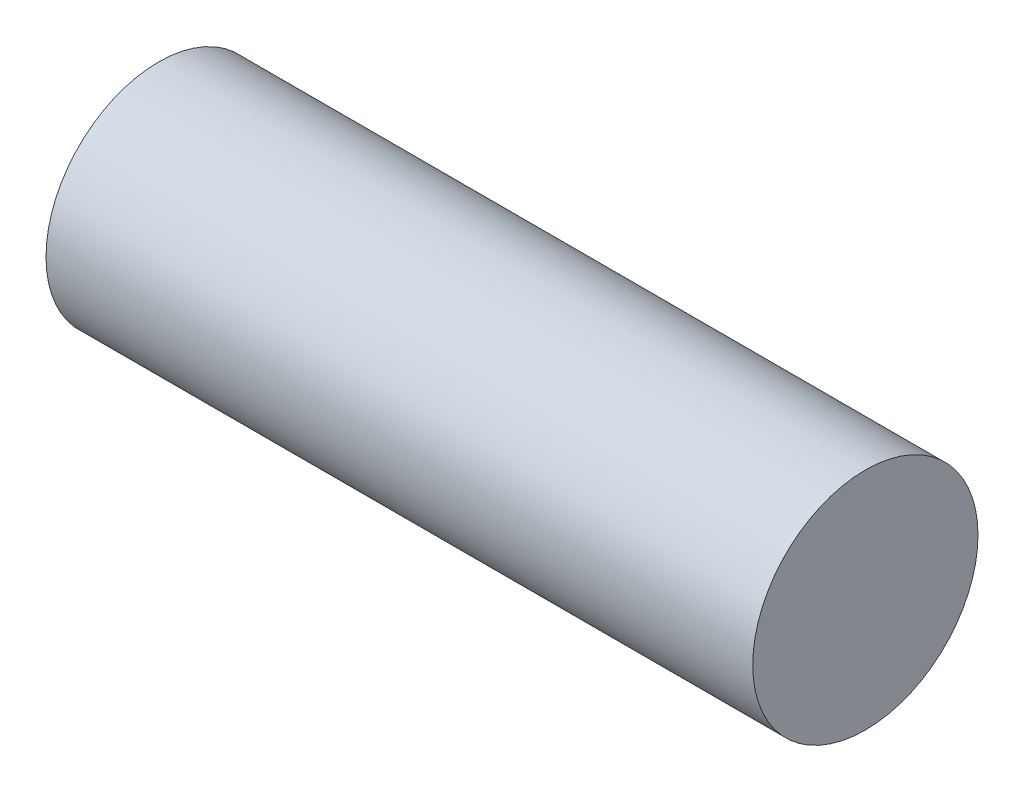
from build123d import *

# Parameters (mm, degrees)
SKETCH2_W = 400
SKETCH2_H = 63.75


with BuildPart() as part:
    # Sketch2 → Revolve1 (revolve)
    with BuildSketch(Plane(origin=(0, 0, 0), x_dir=(1, 0, 0), z_dir=(0, 1, 0))):
        with Locations((200, 31.875)):
            Rectangle(SKETCH2_W, SKETCH2_H)
    revolve(axis=Axis((400, 0, -63.75), (-1, 0, 0)))


solid = part.part
